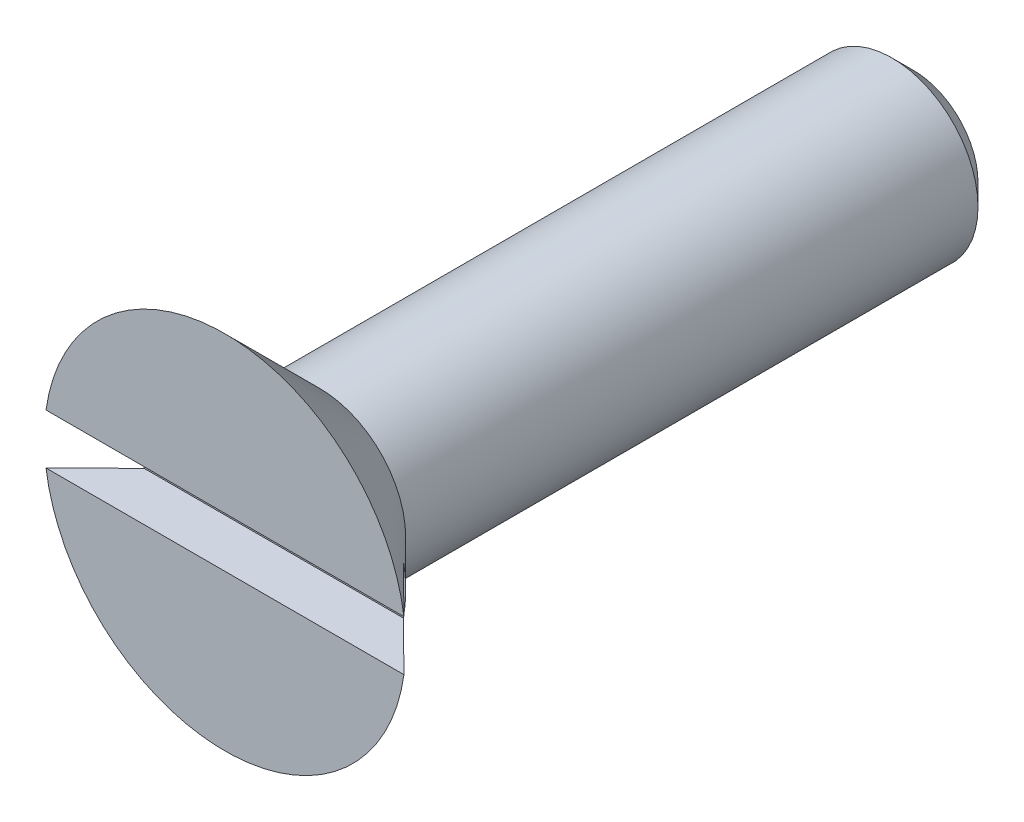
from build123d import *

# Parameters (mm, degrees)
SKETCH9_W          = 6.3
SKETCH9_H          = 0.875
CUT_EXTRUDE1_DEPTH = 0.85


with BuildPart() as part:
    # Sketch3 → Revolve1 (revolve)
    with BuildSketch(Plane(origin=(0, 0, 0), x_dir=(0, 0, -1), z_dir=(1, 0, 0))):
        Polygon((-1.7, 3.15), (-0.05, 1.5), (9.925, 1.5), (10.3, 1.125), (10.3, 0), (-1.7, 0), align=None)
    revolve(axis=Axis((0, 0, 1.7), (0, 0, -1)))

    # Sketch9 → Cut-Extrude1 (cut)
    with BuildSketch(Plane.XY.offset(1.7)):
        Rectangle(SKETCH9_W, SKETCH9_H)
    extrude(amount=-CUT_EXTRUDE1_DEPTH, mode=Mode.SUBTRACT)


solid = part.part
